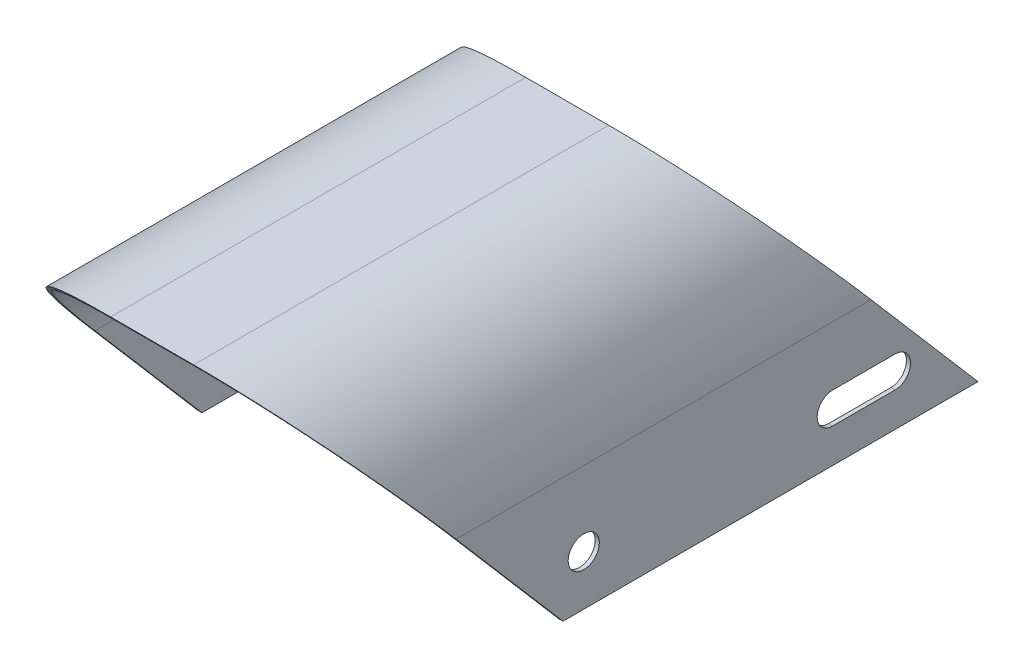
from build123d import *

# Parameters (mm, degrees)
BOSS_EXTRUDE1_DEPTH = 196.85
CUT_EXTRUDE1_DEPTH  = 152.4
SKETCH3_R           = 4.7625
CUT_EXTRUDE2_DEPTH  = 152.4


with BuildPart() as part:
    # Sketch1 → Boss-Extrude1 (new body)
    with BuildSketch(Plane.XY):
        with BuildLine():
            Line((-5.602925898, 0), (-4.332925898, 0))
            Line((-4.332925898, 0), (-4.332925898, 38.1))
            ThreePointArc((-4.332925898, 38.1), (7.942228903, 67.7348452), (37.577074102, 80.01))
            Line((37.577074102, 80.01), (62.977074102, 80.01))
            ThreePointArc((62.977074102, 80.01), (92.611919302, 67.7348452), (104.887074102, 38.1))
            Line((104.887074102, 38.1), (104.887074102, 0))
            Line((104.887074102, 0), (106.157074102, 0))
            Line((106.157074102, 0), (106.157074102, 38.1))
            ThreePointArc((106.157074102, 38.1), (93.509944914, 68.632870812), (62.977074102, 81.28))
            Line((62.977074102, 81.28), (37.577074102, 81.28))
            ThreePointArc((37.577074102, 81.28), (7.04420329, 68.632870812), (-5.602925898, 38.1))
            Line((-5.602925898, 38.1), (-5.602925898, 0))
        make_face()
    extrude(amount=BOSS_EXTRUDE1_DEPTH)

    # Sketch2 → Cut-Extrude1 (cut)
    with BuildSketch(Plane.ZY.offset(5.602925898)):
        Polygon((0, 0), (69.85, 81.28), (0, 81.28), align=None)
        Polygon((196.85, 81.28), (127, 0), (196.85, 0), align=None)
    extrude(amount=-CUT_EXTRUDE1_DEPTH, mode=Mode.SUBTRACT)

    # Sketch3 → Cut-Extrude2 (cut)
    with BuildSketch(Plane.ZY.offset(5.602925898)):
        with Locations((120.65, 15.24)):
            Circle(SKETCH3_R)
        with BuildLine():
            Line((25.4, 20.0025), (44.45, 20.0025))
            ThreePointArc((44.45, 20.0025), (49.2125, 15.24), (44.45, 10.4775))
            Line((44.45, 10.4775), (25.4, 10.4775))
            ThreePointArc((25.4, 10.4775), (20.6375, 15.24), (25.4, 20.0025))
        make_face()
    extrude(amount=-CUT_EXTRUDE2_DEPTH, mode=Mode.SUBTRACT)


solid = part.part
